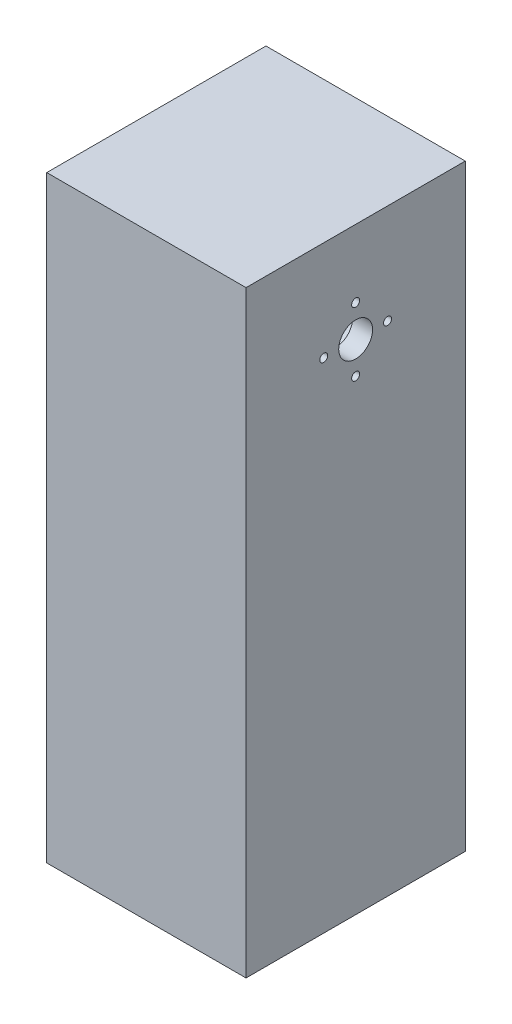
from build123d import *

# Parameters (mm, degrees)
SKETCH1_W               = 50
SKETCH1_H               = 150
BOSS_EXTRUDE1_DEPTH     = 55
CUT_EXTRUDE1_DEPTH      = 168.406690428
CUT_EXTRUDE1_DEPTH_BACK = 45
SKETCH2_R               = 10.25
SKETCH7_R               = 1
SKETCH7_R_2             = 4.25
CUT_EXTRUDE3_DEPTH      = 10
BOSS_EXTRUDE2_START     = 45
SKETCH8_R               = 10.25
SKETCH8_R_2             = 1
SKETCH8_R_3             = 4.25
BOSS_EXTRUDE2_DEPTH     = 45
SKETCH9_R               = 10.25
CUT_EXTRUDE4_DEPTH      = 45


with BuildPart() as part:
    # Sketch1 → Boss-Extrude1 (new body)
    with BuildSketch(Plane.XY):
        with Locations((0, -75)):
            Rectangle(SKETCH1_W, SKETCH1_H)
    extrude(amount=-BOSS_EXTRUDE1_DEPTH)

    # Sketch2 → Cut-Extrude1 (cut, two sides: drawn at the far end of the back side and taken through both)
    with BuildSketch(Plane(origin=(25, 0, 0), x_dir=(0, 0, -1), z_dir=(1, 0, 0)).offset(-CUT_EXTRUDE1_DEPTH_BACK)):
        with Locations(Location((27.5, -25, 0), (0, 0, 270))):
            Circle(SKETCH2_R)
    extrude(amount=CUT_EXTRUDE1_DEPTH + CUT_EXTRUDE1_DEPTH_BACK, mode=Mode.SUBTRACT)

    # Sketch7 → Cut-Extrude3 (cut)
    with BuildSketch(Plane(origin=(-20, 0, 0), x_dir=(0, 0, -1), z_dir=(1, 0, 0))):
        with Locations(Location((27.5, -17, 0), (0, 0, 90))):
            Circle(SKETCH7_R)
        with Locations(Location((35.5, -25, 0), (0, 0, 90))):
            Circle(SKETCH7_R)
        with Locations(Location((27.5, -33, 0), (0, 0, 90))):
            Circle(SKETCH7_R)
        with Locations(Location((19.5, -25, 0), (0, 0, 90))):
            Circle(SKETCH7_R)
        with Locations(Location((27.5, -25, 0), (0, 0, 90))):
            Circle(SKETCH7_R_2)
    extrude(amount=-CUT_EXTRUDE3_DEPTH, mode=Mode.SUBTRACT)

    # Sketch8 → Boss-Extrude2 (add)
    with BuildSketch(Plane(origin=(-20, 0, 0), x_dir=(0, 0, -1), z_dir=(1, 0, 0)).offset(BOSS_EXTRUDE2_START)):
        with Locations((27.5, -25)):
            Circle(SKETCH8_R)
        with Locations(Location((27.5, -17, 0), (0, 0, 90))):
            Circle(SKETCH8_R_2, mode=Mode.SUBTRACT)
        with Locations(Location((27.5, -25, 0), (0, 0, 90))):
            Circle(SKETCH8_R_3, mode=Mode.SUBTRACT)
        with Locations(Location((35.5, -25, 0), (0, 0, 90))):
            Circle(SKETCH8_R_2, mode=Mode.SUBTRACT)
        with Locations(Location((27.5, -33, 0), (0, 0, 90))):
            Circle(SKETCH8_R_2, mode=Mode.SUBTRACT)
        with Locations(Location((19.5, -25, 0), (0, 0, 90))):
            Circle(SKETCH8_R_2, mode=Mode.SUBTRACT)
    extrude(amount=-BOSS_EXTRUDE2_DEPTH)

    # Sketch9 → Cut-Extrude4 (cut)
    with BuildSketch(Plane.ZY.offset(25)):
        with Locations(Location((-27.5, -25, 0), (0, 0, 270))):
            Circle(SKETCH9_R)
    extrude(amount=-CUT_EXTRUDE4_DEPTH, mode=Mode.SUBTRACT)


solid = part.part
